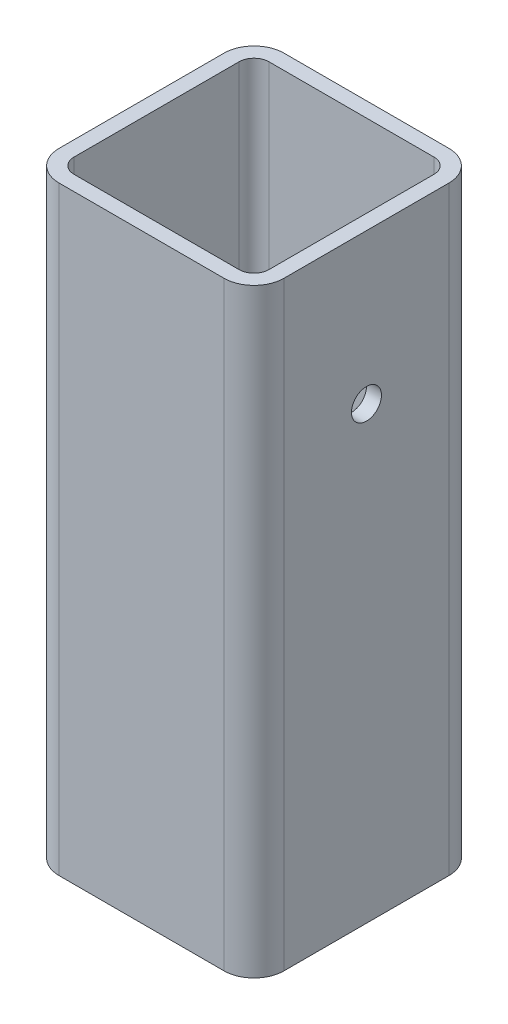
from build123d import *

# Parameters (mm, degrees)
EXTRUDE_1_DEPTH          = 40
CUT_EXTRUDE_1_DEPTH      = 46.276925691
CUT_EXTRUDE_1_DEPTH_BACK = 46.276925691
SKETCH_2_R               = 2


with BuildPart() as part:
    # 草图1 → 凸台-拉伸1 (new, symmetric)
    with BuildSketch(Plane(origin=(0, 0, 0), x_dir=(1, 0, 0), z_dir=(0, 1, 0))):
        with BuildLine():
            Line((-11, -15), (11, -15))
            ThreePointArc((11, -15), (13.828427125, -13.828427125), (15, -11))
            Line((15, -11), (15, 11))
            ThreePointArc((15, 11), (13.828427125, 13.828427125), (11, 15))
            Line((11, 15), (-11, 15))
            ThreePointArc((-11, 15), (-13.828427125, 13.828427125), (-15, 11))
            Line((-15, 11), (-15, -11))
            ThreePointArc((-15, -11), (-13.828427125, -13.828427125), (-11, -15))
        make_face()
        with BuildLine():
            Line((-11, -13), (11, -13))
            ThreePointArc((11, -13), (12.414213562, -12.414213562), (13, -11))
            Line((13, -11), (13, 11))
            ThreePointArc((13, 11), (12.414213562, 12.414213562), (11, 13))
            Line((11, 13), (-11, 13))
            ThreePointArc((-11, 13), (-12.414213562, 12.414213562), (-13, 11))
            Line((-13, 11), (-13, -11))
            ThreePointArc((-13, -11), (-12.414213562, -12.414213562), (-11, -13))
        make_face(mode=Mode.SUBTRACT)
    extrude(amount=EXTRUDE_1_DEPTH, both=True)

    # 草图2 → 切除-拉伸1 (cut, two sides: drawn at the far end of the back side and taken through both)
    with BuildSketch(Plane(origin=(0, 0, 0), x_dir=(0, 0, -1), z_dir=(1, 0, 0)).offset(-CUT_EXTRUDE_1_DEPTH_BACK)):
        with Locations((0, 20)):
            Circle(SKETCH_2_R)
    extrude(amount=CUT_EXTRUDE_1_DEPTH + CUT_EXTRUDE_1_DEPTH_BACK, mode=Mode.SUBTRACT)


solid = part.part
